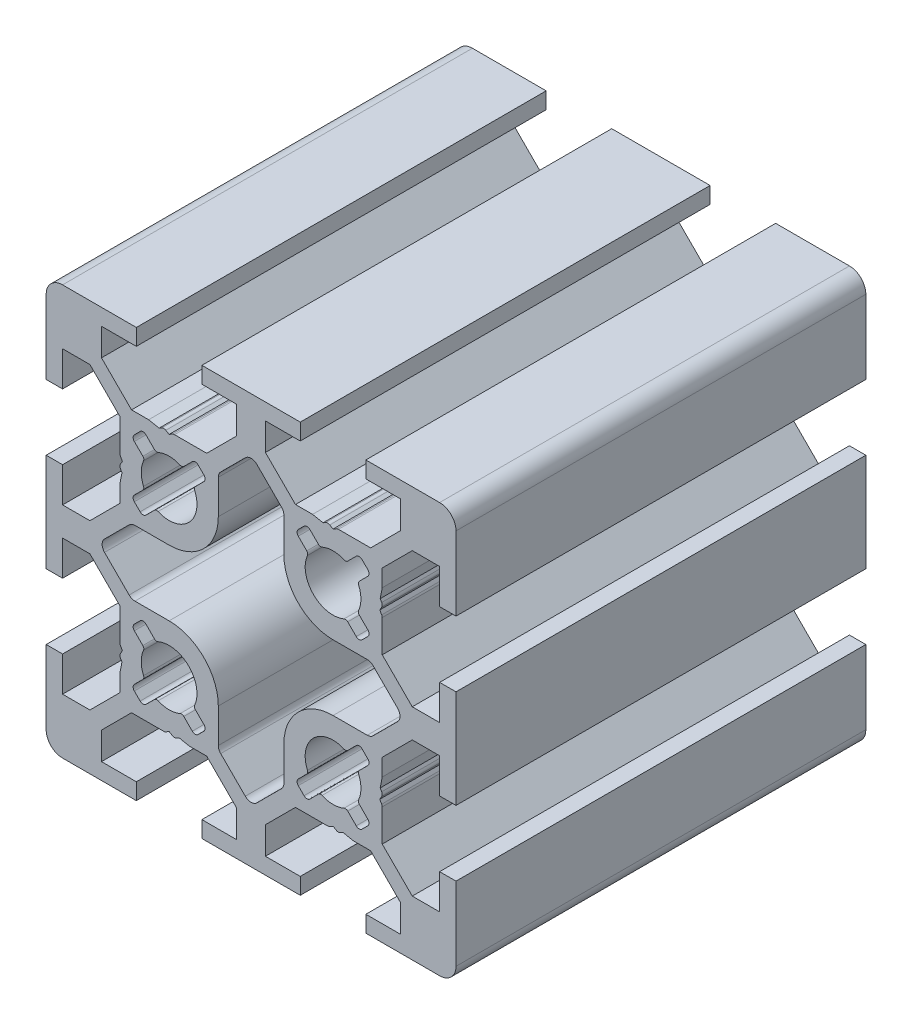
from build123d import *

# Parameters (mm, degrees)
BOSS_EXTRUDE1_DEPTH = 50
CUT_EXTRUDE1_DEPTH  = 50
CUT_EXTRUDE2_DEPTH  = 50
CUT_EXTRUDE3_DEPTH  = 50
CUT_EXTRUDE4_DEPTH  = 50


with BuildPart() as part:
    # Sketch1 → Boss-Extrude1 (new body)
    with BuildSketch(Plane.XY):
        with BuildLine():
            Line((-25, 23), (-25, 14))
            Line((-25, 14), (-23, 14))
            Line((-23, 14), (-23, 18.25))
            Line((-23, 18.25), (-19.664213562, 18.25))
            Line((-19.664213562, 18.25), (-16, 14.585786438))
            Line((-16, 14.585786438), (-16, 10.653589838))
            ThreePointArc((-16, 10.653589838), (-15.982962913, 10.524180316), (-15.933012702, 10.403589838))
            Line((-15.933012702, 10.403589838), (-15.7, 10))
            Line((-15.7, 10), (-15.933012702, 9.596410162))
            ThreePointArc((-15.933012702, 9.596410162), (-16, 9.346410162), (-15.933012702, 9.096410162))
            Line((-15.933012702, 9.096410162), (-15.750976592, 8.781114371))
            Line((-15.750976592, 8.781114371), (-16, 7.5))
            Line((-16, 7.5), (-16, 5.414213562))
            Line((-16, 5.414213562), (-19.664213562, 1.75))
            Line((-19.664213562, 1.75), (-23, 1.75))
            Line((-23, 1.75), (-23, 6))
            Line((-23, 6), (-25, 6))
            Line((-25, 6), (-25, -6))
            Line((-25, -6), (-23, -6))
            Line((-23, -6), (-23, -1.75))
            Line((-23, -1.75), (-19.664213562, -1.75))
            Line((-19.664213562, -1.75), (-16, -5.414213562))
            Line((-16, -5.414213562), (-16, -9.346410162))
            ThreePointArc((-16, -9.346410162), (-15.982962913, -9.475819684), (-15.933012702, -9.596410162))
            Line((-15.933012702, -9.596410162), (-15.7, -10))
            Line((-15.7, -10), (-15.933012702, -10.403589838))
            ThreePointArc((-15.933012702, -10.403589838), (-16, -10.653589838), (-15.933012702, -10.903589838))
            Line((-15.933012702, -10.903589838), (-15.750976592, -11.218885629))
            Line((-15.750976592, -11.218885629), (-16, -12.5))
            Line((-16, -12.5), (-16, -14.585786438))
            Line((-16, -14.585786438), (-19.664213562, -18.25))
            Line((-19.664213562, -18.25), (-23, -18.25))
            Line((-23, -18.25), (-23, -14))
            Line((-23, -14), (-25, -14))
            Line((-25, -14), (-25, -23))
            ThreePointArc((-25, -23), (-24.414213562, -24.414213562), (-23, -25))
            Line((-23, -25), (-14, -25))
            Line((-14, -25), (-14, -23))
            Line((-14, -23), (-18.25, -23))
            Line((-18.25, -23), (-18.25, -19.664213562))
            Line((-18.25, -19.664213562), (-14.585786438, -16))
            Line((-14.585786438, -16), (-10.653589838, -16))
            ThreePointArc((-10.653589838, -16), (-10.524180316, -15.982962913), (-10.403589838, -15.933012702))
            Line((-10.403589838, -15.933012702), (-10, -15.7))
            Line((-10, -15.7), (-9.596410162, -15.933012702))
            ThreePointArc((-9.596410162, -15.933012702), (-9.346410162, -16), (-9.096410162, -15.933012702))
            Line((-9.096410162, -15.933012702), (-8.781114371, -15.750976592))
            Line((-8.781114371, -15.750976592), (-7.5, -16))
            Line((-7.5, -16), (-5.414213562, -16))
            Line((-5.414213562, -16), (-1.75, -19.664213562))
            Line((-1.75, -19.664213562), (-1.75, -23))
            Line((-1.75, -23), (-6, -23))
            Line((-6, -23), (-6, -25))
            Line((-6, -25), (6, -25))
            Line((6, -25), (6, -23))
            Line((6, -23), (1.75, -23))
            Line((1.75, -23), (1.75, -19.664213562))
            Line((1.75, -19.664213562), (5.414213562, -16))
            Line((5.414213562, -16), (9.346410162, -16))
            ThreePointArc((9.346410162, -16), (9.475819684, -15.982962913), (9.596410162, -15.933012702))
            Line((9.596410162, -15.933012702), (10, -15.7))
            Line((10, -15.7), (10.403589838, -15.933012702))
            ThreePointArc((10.403589838, -15.933012702), (10.653589838, -16), (10.903589838, -15.933012702))
            Line((10.903589838, -15.933012702), (11.218885629, -15.750976592))
            Line((11.218885629, -15.750976592), (12.5, -16))
            Line((12.5, -16), (14.585786438, -16))
            Line((14.585786438, -16), (18.25, -19.664213562))
            Line((18.25, -19.664213562), (18.25, -23))
            Line((18.25, -23), (14, -23))
            Line((14, -23), (14, -25))
            Line((14, -25), (23, -25))
            ThreePointArc((23, -25), (24.414213562, -24.414213562), (25, -23))
            Line((25, -23), (25, -14))
            Line((25, -14), (23, -14))
            Line((23, -14), (23, -18.25))
            Line((23, -18.25), (19.664213562, -18.25))
            Line((19.664213562, -18.25), (16, -14.585786438))
            Line((16, -14.585786438), (16, -10.653589838))
            ThreePointArc((16, -10.653589838), (15.982962913, -10.524180316), (15.933012702, -10.403589838))
            Line((15.933012702, -10.403589838), (15.7, -10))
            Line((15.7, -10), (15.933012702, -9.596410162))
            ThreePointArc((15.933012702, -9.596410162), (16, -9.346410162), (15.933012702, -9.096410162))
            Line((15.933012702, -9.096410162), (15.750976592, -8.781114371))
            Line((15.750976592, -8.781114371), (16, -7.5))
            Line((16, -7.5), (16, -5.414213562))
            Line((16, -5.414213562), (19.664213562, -1.75))
            Line((19.664213562, -1.75), (23, -1.75))
            Line((23, -1.75), (23, -6))
            Line((23, -6), (25, -6))
            Line((25, -6), (25, 6))
            Line((25, 6), (23, 6))
            Line((23, 6), (23, 1.75))
            Line((23, 1.75), (19.664213562, 1.75))
            Line((19.664213562, 1.75), (16, 5.414213562))
            Line((16, 5.414213562), (16, 9.346410162))
            ThreePointArc((16, 9.346410162), (15.982962913, 9.475819684), (15.933012702, 9.596410162))
            Line((15.933012702, 9.596410162), (15.7, 10))
            Line((15.7, 10), (15.933012702, 10.403589838))
            ThreePointArc((15.933012702, 10.403589838), (16, 10.653589838), (15.933012702, 10.903589838))
            Line((15.933012702, 10.903589838), (15.750976592, 11.218885629))
            Line((15.750976592, 11.218885629), (16, 12.5))
            Line((16, 12.5), (16, 14.585786438))
            Line((16, 14.585786438), (19.664213562, 18.25))
            Line((19.664213562, 18.25), (23, 18.25))
            Line((23, 18.25), (23, 14))
            Line((23, 14), (25, 14))
            Line((25, 14), (25, 23))
            ThreePointArc((25, 23), (24.414213562, 24.414213562), (23, 25))
            Line((23, 25), (14, 25))
            Line((14, 25), (14, 23))
            Line((14, 23), (18.25, 23))
            Line((18.25, 23), (18.25, 19.664213562))
            Line((18.25, 19.664213562), (14.585786438, 16))
            Line((14.585786438, 16), (10.653589838, 16))
            ThreePointArc((10.653589838, 16), (10.524180316, 15.982962913), (10.403589838, 15.933012702))
            Line((10.403589838, 15.933012702), (10, 15.7))
            Line((10, 15.7), (9.596410162, 15.933012702))
            ThreePointArc((9.596410162, 15.933012702), (9.346410162, 16), (9.096410162, 15.933012702))
            Line((9.096410162, 15.933012702), (8.781114371, 15.750976592))
            Line((8.781114371, 15.750976592), (7.5, 16))
            Line((7.5, 16), (5.414213562, 16))
            Line((5.414213562, 16), (1.75, 19.664213562))
            Line((1.75, 19.664213562), (1.75, 23))
            Line((1.75, 23), (6, 23))
            Line((6, 23), (6, 25))
            Line((6, 25), (-6, 25))
            Line((-6, 25), (-6, 23))
            Line((-6, 23), (-1.75, 23))
            Line((-1.75, 23), (-1.75, 19.664213562))
            Line((-1.75, 19.664213562), (-5.414213562, 16))
            Line((-5.414213562, 16), (-9.346410162, 16))
            ThreePointArc((-9.346410162, 16), (-9.475819684, 15.982962913), (-9.596410162, 15.933012702))
            Line((-9.596410162, 15.933012702), (-10, 15.7))
            Line((-10, 15.7), (-10.403589838, 15.933012702))
            ThreePointArc((-10.403589838, 15.933012702), (-10.653589838, 16), (-10.903589838, 15.933012702))
            Line((-10.903589838, 15.933012702), (-11.218885629, 15.750976592))
            Line((-11.218885629, 15.750976592), (-12.5, 16))
            Line((-12.5, 16), (-14.585786438, 16))
            Line((-14.585786438, 16), (-18.25, 19.664213562))
            Line((-18.25, 19.664213562), (-18.25, 23))
            Line((-18.25, 23), (-14, 23))
            Line((-14, 23), (-14, 25))
            Line((-14, 25), (-23, 25))
            ThreePointArc((-23, 25), (-24.414213562, 24.414213562), (-25, 23))
        make_face()
        with BuildLine():
            Line((-17.878679656, -0.707106781), (-14.878679656, -3.707106781))
            ThreePointArc((-14.878679656, -3.707106781), (-14.554256308, -3.923879533), (-14.171572875, -4))
            Line((-14.171572875, -4), (-10, -4))
            ThreePointArc((-10, -4), (-5.757359313, -5.757359313), (-4, -10))
            Line((-4, -10), (-4, -14.171572875))
            ThreePointArc((-4, -14.171572875), (-3.923879533, -14.554256308), (-3.707106781, -14.878679656))
            Line((-3.707106781, -14.878679656), (-0.707106781, -17.878679656))
            ThreePointArc((-0.707106781, -17.878679656), (0, -18.171572875), (0.707106781, -17.878679656))
            Line((0.707106781, -17.878679656), (3.707106781, -14.878679656))
            ThreePointArc((3.707106781, -14.878679656), (3.923879533, -14.554256308), (4, -14.171572875))
            Line((4, -14.171572875), (4, -10))
            ThreePointArc((4, -10), (5.757359313, -5.757359313), (10, -4))
            Line((10, -4), (14.171572875, -4))
            ThreePointArc((14.171572875, -4), (14.554256308, -3.923879533), (14.878679656, -3.707106781))
            Line((14.878679656, -3.707106781), (17.878679656, -0.707106781))
            ThreePointArc((17.878679656, -0.707106781), (18.171572875, 0), (17.878679656, 0.707106781))
            Line((17.878679656, 0.707106781), (14.878679656, 3.707106781))
            ThreePointArc((14.878679656, 3.707106781), (14.554256308, 3.923879533), (14.171572875, 4))
            Line((14.171572875, 4), (10, 4))
            ThreePointArc((10, 4), (5.757359313, 5.757359313), (4, 10))
            Line((4, 10), (4, 14.171572875))
            ThreePointArc((4, 14.171572875), (3.923879533, 14.554256308), (3.707106781, 14.878679656))
            Line((3.707106781, 14.878679656), (0.707106781, 17.878679656))
            ThreePointArc((0.707106781, 17.878679656), (0, 18.171572875), (-0.707106781, 17.878679656))
            Line((-0.707106781, 17.878679656), (-3.707106781, 14.878679656))
            ThreePointArc((-3.707106781, 14.878679656), (-3.923879533, 14.554256308), (-4, 14.171572875))
            Line((-4, 14.171572875), (-4, 10))
            ThreePointArc((-4, 10), (-5.757359313, 5.757359313), (-10, 4))
            Line((-10, 4), (-14.171572875, 4))
            ThreePointArc((-14.171572875, 4), (-14.554256308, 3.923879533), (-14.878679656, 3.707106781))
            Line((-14.878679656, 3.707106781), (-17.878679656, 0.707106781))
            ThreePointArc((-17.878679656, 0.707106781), (-18.171572875, 0), (-17.878679656, -0.707106781))
        make_face(mode=Mode.SUBTRACT)
    extrude(amount=-BOSS_EXTRUDE1_DEPTH)

    # Sketch2 → Cut-Extrude1 (cut)
    with BuildSketch(Plane.XY):
        with BuildLine():
            Line((-14.242640687, 12.828427125), (-13.205105981, 11.790892418))
            ThreePointArc((-13.205105981, 11.790892418), (-13.095045749, 11.583064884), (-13.120796199, 11.349307631))
            ThreePointArc((-13.120796199, 11.349307631), (-13.4, 10.000000021), (-13.120796216, 8.650692407))
            ThreePointArc((-13.120796216, 8.650692407), (-13.095045745, 8.416935137), (-13.205105981, 8.209107582))
            Line((-13.205105981, 8.209107582), (-14.242640687, 7.171572875))
            ThreePointArc((-14.242640687, 7.171572875), (-14.389087297, 6.818019485), (-14.242640687, 6.464466094))
            Line((-14.242640687, 6.464466094), (-13.535533906, 5.757359313))
            ThreePointArc((-13.535533906, 5.757359313), (-13.181980515, 5.610912703), (-12.828427125, 5.757359313))
            Line((-12.828427125, 5.757359313), (-11.790892418, 6.794894019))
            ThreePointArc((-11.790892418, 6.794894019), (-11.583064884, 6.904954251), (-11.349307631, 6.879203801))
            ThreePointArc((-11.349307631, 6.879203801), (-7.595836944, 7.595836944), (-6.879203801, 11.349307631))
            ThreePointArc((-6.879203801, 11.349307631), (-6.904954251, 11.583064884), (-6.794894019, 11.790892418))
            Line((-6.794894019, 11.790892418), (-5.757359313, 12.828427125))
            ThreePointArc((-5.757359313, 12.828427125), (-5.610912703, 13.181980515), (-5.757359313, 13.535533906))
            Line((-5.757359313, 13.535533906), (-6.464466094, 14.242640687))
            ThreePointArc((-6.464466094, 14.242640687), (-6.818019485, 14.389087297), (-7.171572875, 14.242640687))
            Line((-7.171572875, 14.242640687), (-8.209107582, 13.205105981))
            ThreePointArc((-8.209107582, 13.205105981), (-8.416935116, 13.095045749), (-8.650692369, 13.120796199))
            ThreePointArc((-8.650692369, 13.120796199), (-9.999999979, 13.4), (-11.349307593, 13.120796216))
            ThreePointArc((-11.349307593, 13.120796216), (-11.583064863, 13.095045745), (-11.790892418, 13.205105981))
            Line((-11.790892418, 13.205105981), (-12.828427125, 14.242640687))
            ThreePointArc((-12.828427125, 14.242640687), (-13.181980515, 14.389087297), (-13.535533906, 14.242640687))
            Line((-13.535533906, 14.242640687), (-14.242640687, 13.535533906))
            ThreePointArc((-14.242640687, 13.535533906), (-14.389087297, 13.181980515), (-14.242640687, 12.828427125))
        make_face()
    extrude(amount=-CUT_EXTRUDE1_DEPTH, mode=Mode.SUBTRACT)

    # Sketch3 → Cut-Extrude2 (cut)
    with BuildSketch(Plane.XY):
        with BuildLine():
            Line((-12.828427125, -14.242640687), (-11.790892418, -13.205105981))
            ThreePointArc((-11.790892418, -13.205105981), (-11.583064884, -13.095045749), (-11.349307631, -13.120796199))
            ThreePointArc((-11.349307631, -13.120796199), (-10.000000021, -13.4), (-8.650692407, -13.120796216))
            ThreePointArc((-8.650692407, -13.120796216), (-8.416935137, -13.095045745), (-8.209107582, -13.205105981))
            Line((-8.209107582, -13.205105981), (-7.171572875, -14.242640687))
            ThreePointArc((-7.171572875, -14.242640687), (-6.818019485, -14.389087297), (-6.464466094, -14.242640687))
            Line((-6.464466094, -14.242640687), (-5.757359313, -13.535533906))
            ThreePointArc((-5.757359313, -13.535533906), (-5.610912703, -13.181980515), (-5.757359313, -12.828427125))
            Line((-5.757359313, -12.828427125), (-6.794894019, -11.790892418))
            ThreePointArc((-6.794894019, -11.790892418), (-6.904954251, -11.583064884), (-6.879203801, -11.349307631))
            ThreePointArc((-6.879203801, -11.349307631), (-7.595836944, -7.595836944), (-11.349307631, -6.879203801))
            ThreePointArc((-11.349307631, -6.879203801), (-11.583064884, -6.904954251), (-11.790892418, -6.794894019))
            Line((-11.790892418, -6.794894019), (-12.828427125, -5.757359313))
            ThreePointArc((-12.828427125, -5.757359313), (-13.181980515, -5.610912703), (-13.535533906, -5.757359313))
            Line((-13.535533906, -5.757359313), (-14.242640687, -6.464466094))
            ThreePointArc((-14.242640687, -6.464466094), (-14.389087297, -6.818019485), (-14.242640687, -7.171572875))
            Line((-14.242640687, -7.171572875), (-13.205105981, -8.209107582))
            ThreePointArc((-13.205105981, -8.209107582), (-13.095045749, -8.416935116), (-13.120796199, -8.650692369))
            ThreePointArc((-13.120796199, -8.650692369), (-13.4, -9.999999979), (-13.120796216, -11.349307593))
            ThreePointArc((-13.120796216, -11.349307593), (-13.095045745, -11.583064863), (-13.205105981, -11.790892418))
            Line((-13.205105981, -11.790892418), (-14.242640687, -12.828427125))
            ThreePointArc((-14.242640687, -12.828427125), (-14.389087297, -13.181980515), (-14.242640687, -13.535533906))
            Line((-14.242640687, -13.535533906), (-13.535533906, -14.242640687))
            ThreePointArc((-13.535533906, -14.242640687), (-13.181980515, -14.389087297), (-12.828427125, -14.242640687))
        make_face()
    extrude(amount=-CUT_EXTRUDE2_DEPTH, mode=Mode.SUBTRACT)

    # Sketch4 → Cut-Extrude3 (cut)
    with BuildSketch(Plane.XY):
        with BuildLine():
            Line((14.242640687, -12.828427125), (13.205105981, -11.790892418))
            ThreePointArc((13.205105981, -11.790892418), (13.095045749, -11.583064884), (13.120796199, -11.349307631))
            ThreePointArc((13.120796199, -11.349307631), (13.4, -10.000000021), (13.120796216, -8.650692407))
            ThreePointArc((13.120796216, -8.650692407), (13.095045745, -8.416935137), (13.205105981, -8.209107582))
            Line((13.205105981, -8.209107582), (14.242640687, -7.171572875))
            ThreePointArc((14.242640687, -7.171572875), (14.389087297, -6.818019485), (14.242640687, -6.464466094))
            Line((14.242640687, -6.464466094), (13.535533906, -5.757359313))
            ThreePointArc((13.535533906, -5.757359313), (13.181980515, -5.610912703), (12.828427125, -5.757359313))
            Line((12.828427125, -5.757359313), (11.790892418, -6.794894019))
            ThreePointArc((11.790892418, -6.794894019), (11.583064884, -6.904954251), (11.349307631, -6.879203801))
            ThreePointArc((11.349307631, -6.879203801), (7.595836944, -7.595836944), (6.879203801, -11.349307631))
            ThreePointArc((6.879203801, -11.349307631), (6.904954251, -11.583064884), (6.794894019, -11.790892418))
            Line((6.794894019, -11.790892418), (5.757359313, -12.828427125))
            ThreePointArc((5.757359313, -12.828427125), (5.610912703, -13.181980515), (5.757359313, -13.535533906))
            Line((5.757359313, -13.535533906), (6.464466094, -14.242640687))
            ThreePointArc((6.464466094, -14.242640687), (6.818019485, -14.389087297), (7.171572875, -14.242640687))
            Line((7.171572875, -14.242640687), (8.209107582, -13.205105981))
            ThreePointArc((8.209107582, -13.205105981), (8.416935116, -13.095045749), (8.650692369, -13.120796199))
            ThreePointArc((8.650692369, -13.120796199), (9.999999979, -13.4), (11.349307593, -13.120796216))
            ThreePointArc((11.349307593, -13.120796216), (11.583064863, -13.095045745), (11.790892418, -13.205105981))
            Line((11.790892418, -13.205105981), (12.828427125, -14.242640687))
            ThreePointArc((12.828427125, -14.242640687), (13.181980515, -14.389087297), (13.535533906, -14.242640687))
            Line((13.535533906, -14.242640687), (14.242640687, -13.535533906))
            ThreePointArc((14.242640687, -13.535533906), (14.389087297, -13.181980515), (14.242640687, -12.828427125))
        make_face()
    extrude(amount=-CUT_EXTRUDE3_DEPTH, mode=Mode.SUBTRACT)

    # Sketch5 → Cut-Extrude4 (cut)
    with BuildSketch(Plane.XY):
        with BuildLine():
            Line((12.828427125, 14.242640687), (11.790892418, 13.205105981))
            ThreePointArc((11.790892418, 13.205105981), (11.583064884, 13.095045749), (11.349307631, 13.120796199))
            ThreePointArc((11.349307631, 13.120796199), (10.000000021, 13.4), (8.650692407, 13.120796216))
            ThreePointArc((8.650692407, 13.120796216), (8.416935137, 13.095045745), (8.209107582, 13.205105981))
            Line((8.209107582, 13.205105981), (7.171572875, 14.242640687))
            ThreePointArc((7.171572875, 14.242640687), (6.818019485, 14.389087297), (6.464466094, 14.242640687))
            Line((6.464466094, 14.242640687), (5.757359313, 13.535533906))
            ThreePointArc((5.757359313, 13.535533906), (5.610912703, 13.181980515), (5.757359313, 12.828427125))
            Line((5.757359313, 12.828427125), (6.794894019, 11.790892418))
            ThreePointArc((6.794894019, 11.790892418), (6.904954251, 11.583064884), (6.879203801, 11.349307631))
            ThreePointArc((6.879203801, 11.349307631), (7.595836944, 7.595836944), (11.349307631, 6.879203801))
            ThreePointArc((11.349307631, 6.879203801), (11.583064884, 6.904954251), (11.790892418, 6.794894019))
            Line((11.790892418, 6.794894019), (12.828427125, 5.757359313))
            ThreePointArc((12.828427125, 5.757359313), (13.181980515, 5.610912703), (13.535533906, 5.757359313))
            Line((13.535533906, 5.757359313), (14.242640687, 6.464466094))
            ThreePointArc((14.242640687, 6.464466094), (14.389087297, 6.818019485), (14.242640687, 7.171572875))
            Line((14.242640687, 7.171572875), (13.205105981, 8.209107582))
            ThreePointArc((13.205105981, 8.209107582), (13.095045749, 8.416935116), (13.120796199, 8.650692369))
            ThreePointArc((13.120796199, 8.650692369), (13.4, 9.999999979), (13.120796216, 11.349307593))
            ThreePointArc((13.120796216, 11.349307593), (13.095045745, 11.583064863), (13.205105981, 11.790892418))
            Line((13.205105981, 11.790892418), (14.242640687, 12.828427125))
            ThreePointArc((14.242640687, 12.828427125), (14.389087297, 13.181980515), (14.242640687, 13.535533906))
            Line((14.242640687, 13.535533906), (13.535533906, 14.242640687))
            ThreePointArc((13.535533906, 14.242640687), (13.181980515, 14.389087297), (12.828427125, 14.242640687))
        make_face()
    extrude(amount=-CUT_EXTRUDE4_DEPTH, mode=Mode.SUBTRACT)


solid = part.part
